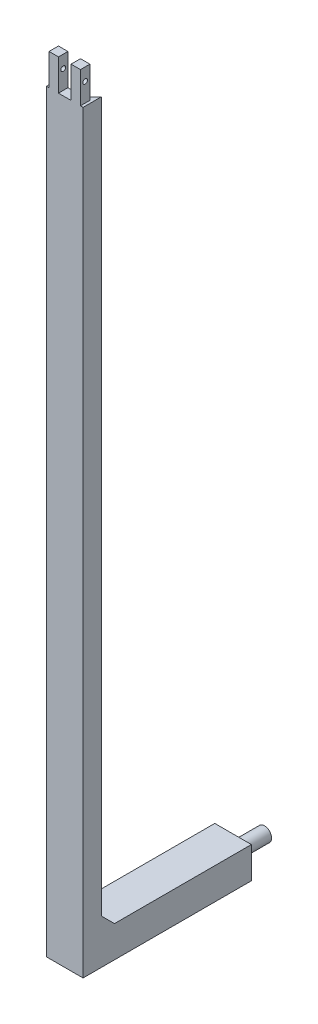
from build123d import *

# Parameters (mm, degrees)
SKETCH2_W           = 6
SKETCH2_H           = 240
BOSS_EXTRUDE1_DEPTH = 3
BOSS_EXTRUDE2_DEPTH = 240
SKETCH5_W           = 3
SKETCH5_H           = 3
BOSS_EXTRUDE3_DEPTH = 10
SKETCH6_R           = 0.75
CUT_EXTRUDE1_DEPTH  = 40
SKETCH7_W           = 11.65685425
SKETCH7_H           = 10
BOSS_EXTRUDE4_DEPTH = 50.58
SKETCH8_R           = 2.25
BOSS_EXTRUDE5_DEPTH = 10
BOSS_EXTRUDE6_DEPTH = 11.656854


with BuildPart() as part:
    # Sketch2 → Boss-Extrude1 (new body)
    with BuildSketch(Plane.XY):
        with Locations((-3, -120)):
            Rectangle(SKETCH2_W, SKETCH2_H)
    extrude(amount=BOSS_EXTRUDE1_DEPTH)

    # Sketch4 → Boss-Extrude2 (add)
    with BuildSketch(Plane(origin=(0, -240, 0), x_dir=(-1, 0, 0), z_dir=(0, -1, 0))):
        Polygon((0, 0), (-2.828427125, 2.828427125), (-2.828427125, -3), (0, -3), align=None)
        Polygon((8.828427125, -3), (6, -3), (6, 0), (8.828427125, 2.828427125), align=None)
    extrude(amount=-BOSS_EXTRUDE2_DEPTH)

    # Sketch5 → Boss-Extrude3 (add)
    with BuildSketch(Plane(origin=(0, 0, 0), x_dir=(1, 0, 0), z_dir=(0, 1, 0))):
        with Locations((-6.5, -1.5)):
            Rectangle(SKETCH5_W, SKETCH5_H)
        with Locations((0.5, -1.5)):
            Rectangle(SKETCH5_W, SKETCH5_H)
    extrude(amount=BOSS_EXTRUDE3_DEPTH)

    # Sketch6 → Cut-Extrude1 (cut)
    with BuildSketch(Plane(origin=(2, 0, 0), x_dir=(0, 0, -1), z_dir=(1, 0, 0))):
        with Locations((-1.5, 6)):
            Circle(SKETCH6_R)
    extrude(amount=-CUT_EXTRUDE1_DEPTH, mode=Mode.SUBTRACT)

    # Sketch7 → Boss-Extrude4 (add)
    with BuildSketch(Plane(origin=(0, 0, 0), x_dir=(-1, 0, 0), z_dir=(0, 0, -1))):
        with Locations((3, -235)):
            Rectangle(SKETCH7_W, SKETCH7_H)
    extrude(amount=BOSS_EXTRUDE4_DEPTH)

    # Sketch8 → Boss-Extrude5 (add)
    with BuildSketch(Plane(origin=(0, 0, -50.58), x_dir=(-1, 0, 0), z_dir=(0, 0, -1))):
        with Locations((3, -235)):
            Circle(SKETCH8_R)
    extrude(amount=BOSS_EXTRUDE5_DEPTH)

    # Sketch9 → Boss-Extrude6 (add)
    with BuildSketch(Plane.ZY.offset(8.828427125)):
        Polygon((-7, -230), (0, -230), (0, -223), align=None)
    extrude(amount=-BOSS_EXTRUDE6_DEPTH)


solid = part.part
